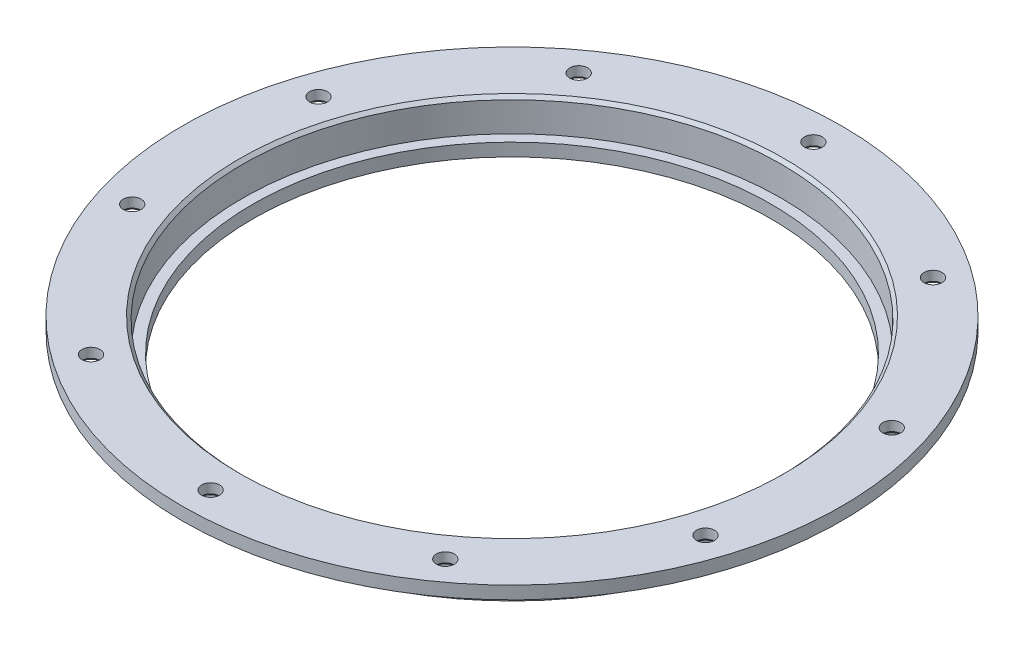
from build123d import *

# Parameters (mm, degrees)
SKETCH_1_R          = 44.5
SKETCH_1_R_2        = 40.5
EXTRUDE_1_DEPTH     = 2
SKETCH_2_R          = 44.5
SKETCH_2_R_2        = 42.1
EXTRUDE_2_DEPTH     = 3.1
SKETCH_3_R          = 51.5
SKETCH_3_R_2        = 42.1
EXTRUDE_3_DEPTH     = 2
SKETCH_6_R          = 1.4
CUT_EXTRUDE_3_DEPTH = 74.177250563
CHAMFER_1_SIZE      = 0.5
CHAMFER_2_SIZE      = 0.5


with BuildPart() as part:
    # 스케치1 → 보스-돌출1 (new body)
    with BuildSketch(Plane(origin=(0, 0, 0), x_dir=(1, 0, 0), z_dir=(0, 1, 0))):
        with Locations(Location((0, 0, 0), (0, 0, 270))):
            Circle(SKETCH_1_R)
        with Locations(Location((0, 0, 0), (0, 0, 270))):
            Circle(SKETCH_1_R_2, mode=Mode.SUBTRACT)
    extrude(amount=EXTRUDE_1_DEPTH)

    # 스케치2 → 보스-돌출2 (add)
    with BuildSketch(Plane(origin=(0, 2, 0), x_dir=(1, 0, 0), z_dir=(0, 1, 0))):
        with Locations(Location((0, 0, 0), (0, 0, 270))):
            Circle(SKETCH_2_R)
        with Locations(Location((0, 0, 0), (0, 0, 90))):
            Circle(SKETCH_2_R_2, mode=Mode.SUBTRACT)
    extrude(amount=EXTRUDE_2_DEPTH)

    # 스케치3 → 보스-돌출3 (add)
    with BuildSketch(Plane(origin=(0, 5.1, 0), x_dir=(1, 0, 0), z_dir=(0, 1, 0))):
        with Locations(Location((0, 0, 0), (0, 0, 270))):
            Circle(SKETCH_3_R)
        with Locations(Location((0, 0, 0), (0, 0, 90))):
            Circle(SKETCH_3_R_2, mode=Mode.SUBTRACT)
    extrude(amount=EXTRUDE_3_DEPTH)

    # 스케치6 → 컷-돌출3 (cut, through all)
    with BuildSketch(Plane(origin=(0, 7.1, 0), x_dir=(1, 0, 0), z_dir=(0, 1, 0))):
        with Locations(Location((0, 47.1, 0), (0, 0, 270))):
            Circle(SKETCH_6_R)
        with Locations(Location((27.684685383, 38.104700435, 0), (0, 0, 270))):
            Circle(SKETCH_6_R)
        with Locations(Location((44.794761918, 14.554700435, 0), (0, 0, 270))):
            Circle(SKETCH_6_R)
        with Locations(Location((44.794761918, -14.554700435, 0), (0, 0, 270))):
            Circle(SKETCH_6_R)
        with Locations(Location((27.684685383, -38.104700435, 0), (0, 0, 270))):
            Circle(SKETCH_6_R)
        with Locations(Location((0, -47.1, 0), (0, 0, 270))):
            Circle(SKETCH_6_R)
        with Locations(Location((-27.684685383, -38.104700435, 0), (0, 0, 270))):
            Circle(SKETCH_6_R)
        with Locations(Location((-44.794761918, -14.554700435, 0), (0, 0, 270))):
            Circle(SKETCH_6_R)
        with Locations(Location((-44.794761918, 14.554700435, 0), (0, 0, 270))):
            Circle(SKETCH_6_R)
        with Locations(Location((-27.684685383, 38.104700435, 0), (0, 0, 270))):
            Circle(SKETCH_6_R)
    extrude(amount=-CUT_EXTRUDE_3_DEPTH, mode=Mode.SUBTRACT)

    # 모따기1
    chamfer_1_edges = [part.edges().sort_by_distance(p)[0] for p in [
        (0, 5.1, -48.5),
        (-27.684685383, 5.1, -39.504700435),
        (-44.794761918, 5.1, -15.954700435),
        (-44.794761918, 5.1, 13.154700435),
        (-27.684685383, 5.1, 36.704700435),
        (0, 5.1, 45.7),
        (27.684685383, 5.1, 36.704700435),
        (44.794761918, 5.1, 13.154700435),
        (44.794761918, 5.1, -15.954700435),
        (27.684685383, 5.1, -39.504700435),
    ]]
    chamfer(chamfer_1_edges, length=CHAMFER_1_SIZE)

    # 모따기2
    chamfer_2_edges = [part.edges().sort_by_distance(p)[0] for p in [
        (0, 5.1, -44.5),
        (0, 7.1, 42.1),
    ]]
    chamfer(chamfer_2_edges, length=CHAMFER_2_SIZE)


solid = part.part
